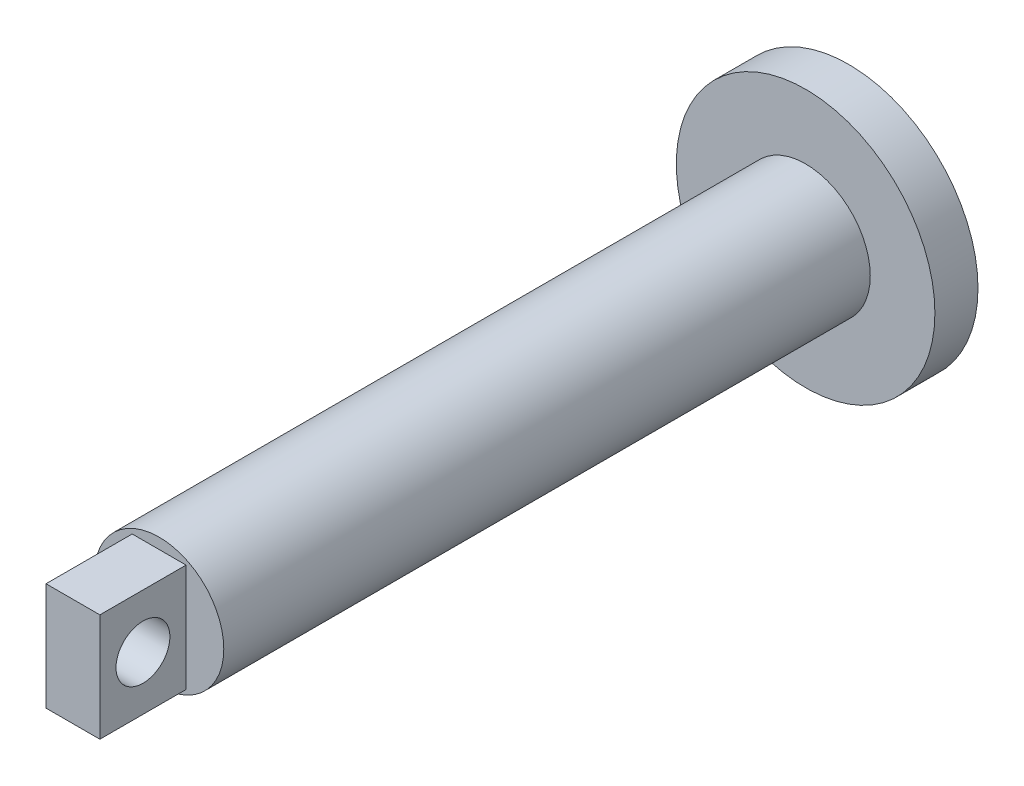
from build123d import *

# Parameters (mm, degrees)
SKETCH1_R           = 6
BOSS_EXTRUDE1_DEPTH = 2
SKETCH2_R           = 3
BOSS_EXTRUDE2_DEPTH = 30
SKETCH3_W           = 2.5
SKETCH3_H           = 5
BOSS_EXTRUDE3_DEPTH = 4
CUT_EXTRUDE1_REACH  = 39.21
SKETCH4_R           = 1.25


with BuildPart() as part:
    # Sketch1 → Boss-Extrude1 (new body)
    with BuildSketch(Plane.XY):
        Circle(SKETCH1_R)
    extrude(amount=BOSS_EXTRUDE1_DEPTH)

    # Sketch2 → Boss-Extrude2 (add)
    with BuildSketch(Plane.XY.offset(2)):
        Circle(SKETCH2_R)
    extrude(amount=BOSS_EXTRUDE2_DEPTH)

    # Sketch3 → Boss-Extrude3 (add)
    with BuildSketch(Plane.XY.offset(32)):
        Rectangle(SKETCH3_W, SKETCH3_H)
    extrude(amount=BOSS_EXTRUDE3_DEPTH)

    # Sketch4 → Cut-Extrude1 (cut, up to next)
    with BuildSketch(Plane.ZY.offset(1.25), mode=Mode.PRIVATE) as cut_extrude1_sk1:
        with Locations((34, 0)):
            Circle(SKETCH4_R)
    cut_extrude1_tool1 = extrude(cut_extrude1_sk1.sketch, amount=-CUT_EXTRUDE1_REACH, mode=Mode.PRIVATE) & part.part
    add(cut_extrude1_tool1.solids().sort_by_distance((-1.25, 0, 34))[0], mode=Mode.SUBTRACT)


solid = part.part
